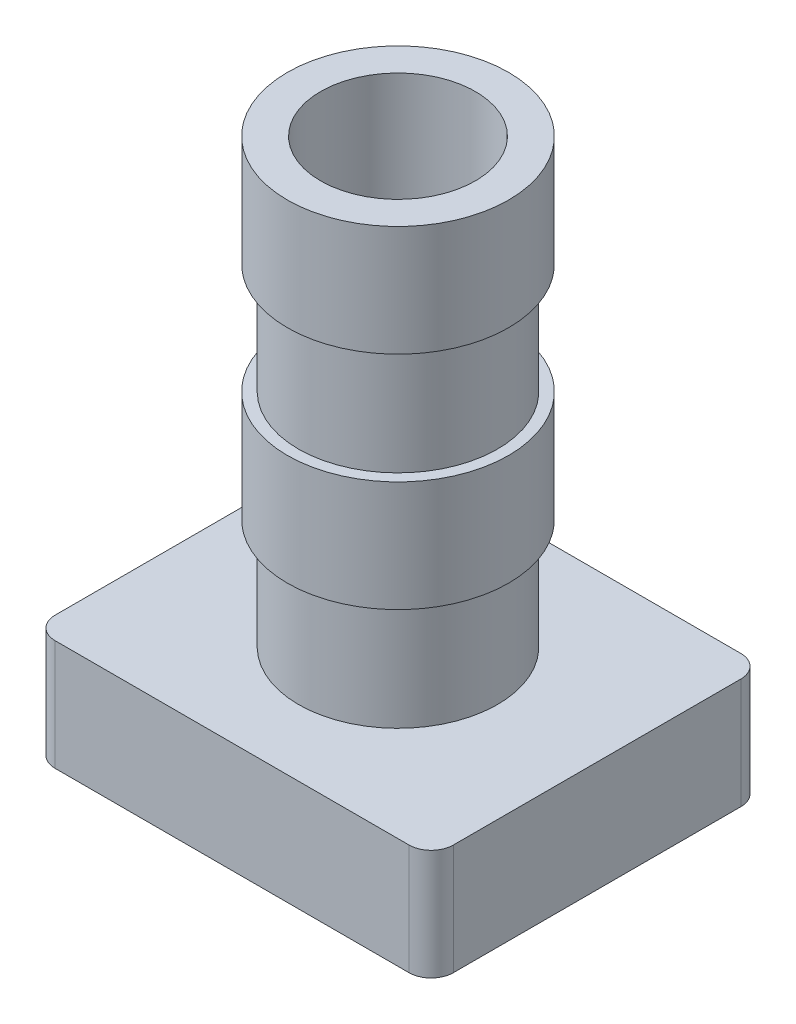
from build123d import *

# Parameters (mm, degrees)
SKETCH1_R           = 4.5
SKETCH1_R_2         = 4
BOSS_EXTRUDE1_DEPTH = 5
SKETCH1_5_R         = 4
CUT_EXTRUDE2_DEPTH  = 13.737739203
SKETCH1_6_R         = 4.5
SKETCH1_6_R_2       = 4
BOSS_EXTRUDE4_DEPTH = 10
SKETCH3_R           = 5
BOSS_EXTRUDE5_DEPTH = 5
SKETCH4_R           = 4.5
BOSS_EXTRUDE6_DEPTH = 5
SKETCH5_R           = 5
BOSS_EXTRUDE7_DEPTH = 5
SKETCH6_R           = 3.5
CUT_EXTRUDE3_DEPTH  = 5


with BuildPart() as part:
    # Sketch1 → Boss-Extrude1 (new body)
    # profile 1 of 5: a face of its own
    with BuildSketch(Plane(origin=(0, 0, 0), x_dir=(1, 0, 0), z_dir=(0, 1, 0))):
        with BuildLine():
            Line((-8, -7.5), (8, -7.5))
            ThreePointArc((8, -7.5), (8.707106781, -7.207106781), (9, -6.5))
            Line((9, -6.5), (9, 6.5))
            ThreePointArc((9, 6.5), (8.707106781, 7.207106781), (8, 7.5))
            Line((8, 7.5), (-8, 7.5))
            ThreePointArc((-8, 7.5), (-8.707106781, 7.207106781), (-9, 6.5))
            Line((-9, 6.5), (-9, -6.5))
            ThreePointArc((-9, -6.5), (-8.707106781, -7.207106781), (-8, -7.5))
        make_face()
        Circle(SKETCH1_R, mode=Mode.SUBTRACT)
        with BuildLine():
            Line((4.5, -5), (4.5, 5))
            ThreePointArc((4.5, 5), (6, 6.5), (7.5, 5))
            Line((7.5, 5), (7.5, -5))
            ThreePointArc((7.5, -5), (6, -6.5), (4.5, -5))
        make_face(mode=Mode.SUBTRACT)
        with BuildLine():
            Line((-4.5, -5), (-4.5, 5))
            ThreePointArc((-4.5, 5), (-6, 6.5), (-7.5, 5))
            Line((-7.5, 5), (-7.5, -5))
            ThreePointArc((-7.5, -5), (-6, -6.5), (-4.5, -5))
        make_face(mode=Mode.SUBTRACT)
    # profile 2 of 5: a face of its own
    with BuildSketch(Plane(origin=(0, 0, 0), x_dir=(1, 0, 0), z_dir=(0, 1, 0))):
        with BuildLine():
            ThreePointArc((-7.5, 5), (-6, 6.5), (-4.5, 5))
            Line((-4.5, 5), (-4.5, -5))
            ThreePointArc((-4.5, -5), (-6, -6.5), (-7.5, -5))
            Line((-7.5, -5), (-7.5, 5))
        make_face()
    # profile 3 of 5: a face of its own
    with BuildSketch(Plane(origin=(0, 0, 0), x_dir=(1, 0, 0), z_dir=(0, 1, 0))):
        Circle(SKETCH1_R)
        Circle(SKETCH1_R_2, mode=Mode.SUBTRACT)
    # profile 4 of 5: a face of its own
    with BuildSketch(Plane(origin=(0, 0, 0), x_dir=(1, 0, 0), z_dir=(0, 1, 0))):
        Circle(SKETCH1_R_2)
    # profile 5 of 5: a face of its own
    with BuildSketch(Plane(origin=(0, 0, 0), x_dir=(1, 0, 0), z_dir=(0, 1, 0))):
        with BuildLine():
            Line((7.5, -5), (7.5, 5))
            ThreePointArc((7.5, 5), (6, 6.5), (4.5, 5))
            Line((4.5, 5), (4.5, -5))
            ThreePointArc((4.5, -5), (6, -6.5), (7.5, -5))
        make_face()
    extrude(amount=BOSS_EXTRUDE1_DEPTH)

    # Sketch1<5> → Cut-Extrude2 (cut, through all)
    with BuildSketch(Plane(origin=(0, 0, 0), x_dir=(1, 0, 0), z_dir=(0, 1, 0))):
        with Locations(Location((0, 0, 0), (0, 0, 270))):
            Circle(SKETCH1_5_R)
    extrude(amount=CUT_EXTRUDE2_DEPTH, mode=Mode.SUBTRACT)

    # Sketch1<6> → Boss-Extrude4 (add)
    with BuildSketch(Plane(origin=(0, 0, 0), x_dir=(1, 0, 0), z_dir=(0, 1, 0))):
        with Locations(Location((0, 0, 0), (0, 0, 270))):
            Circle(SKETCH1_6_R)
        with Locations(Location((0, 0, 0), (0, 0, 270))):
            Circle(SKETCH1_6_R_2, mode=Mode.SUBTRACT)
    extrude(amount=BOSS_EXTRUDE4_DEPTH)

    # Sketch3 → Boss-Extrude5 (add)
    with BuildSketch(Plane(origin=(0, 10, 0), x_dir=(1, 0, 0), z_dir=(0, 1, 0))):
        with Locations(Location((0, 0, 0), (0, 0, 270))):
            Circle(SKETCH3_R)
    extrude(amount=BOSS_EXTRUDE5_DEPTH)

    # Sketch4 → Boss-Extrude6 (add)
    with BuildSketch(Plane(origin=(0, 15, 0), x_dir=(1, 0, 0), z_dir=(0, 1, 0))):
        with Locations(Location((0, 0, 0), (0, 0, 270))):
            Circle(SKETCH4_R)
    extrude(amount=BOSS_EXTRUDE6_DEPTH)

    # Sketch5 → Boss-Extrude7 (add)
    with BuildSketch(Plane(origin=(0, 20, 0), x_dir=(1, 0, 0), z_dir=(0, 1, 0))):
        with Locations(Location((0, 0, 0), (0, 0, 270))):
            Circle(SKETCH5_R)
    extrude(amount=BOSS_EXTRUDE7_DEPTH)

    # Sketch6 → Cut-Extrude3 (cut)
    with BuildSketch(Plane(origin=(0, 25, 0), x_dir=(1, 0, 0), z_dir=(0, 1, 0))):
        with Locations(Location((0, 0, 0), (0, 0, 270))):
            Circle(SKETCH6_R)
    extrude(amount=-CUT_EXTRUDE3_DEPTH, mode=Mode.SUBTRACT)


solid = part.part
